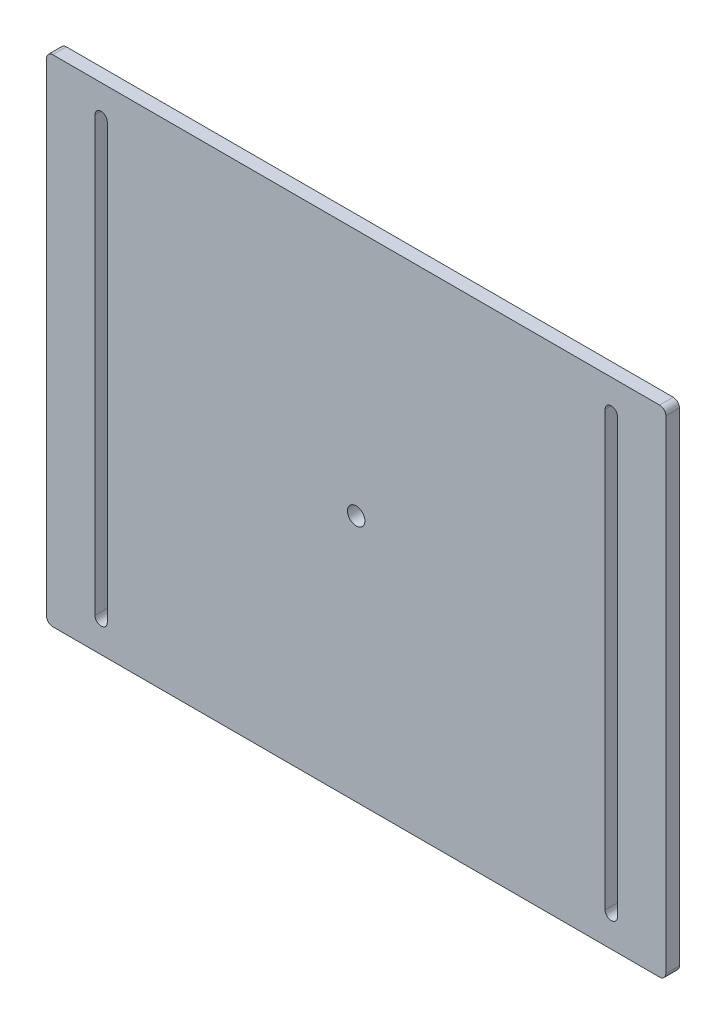
from build123d import *

# Parameters (mm, degrees)
SKETCH1_W               = 254
SKETCH1_H               = 203.2
BOSS_EXTRUDE1_DEPTH     = 5.588
F_1_4_CLEARANCE_HOLE1_D = 7.14248
FILLET1_R               = 2.54


with BuildPart() as part:
    # Sketch1 → Boss-Extrude1 (new body)
    with BuildSketch(Plane.XY):
        Rectangle(SKETCH1_W, SKETCH1_H)
        with BuildLine():
            Line((-102.092252, 88.9), (-102.092252, -88.9))
            ThreePointArc((-102.092252, -88.9), (-104.619552, -91.4273), (-107.146852, -88.9))
            Line((-107.146852, -88.9), (-107.146852, 88.9))
            ThreePointArc((-107.146852, 88.9), (-104.619552, 91.4273), (-102.092252, 88.9))
        make_face(mode=Mode.SUBTRACT)
        with BuildLine():
            Line((107.146852, 88.9), (107.146852, -88.9))
            ThreePointArc((107.146852, -88.9), (104.619552, -91.4273), (102.092252, -88.9))
            Line((102.092252, -88.9), (102.092252, 88.9))
            ThreePointArc((102.092252, 88.9), (104.619552, 91.4273), (107.146852, 88.9))
        make_face(mode=Mode.SUBTRACT)
    extrude(amount=BOSS_EXTRUDE1_DEPTH)

    # 1/4 Clearance Hole1 (through all)
    with Locations(Plane.XY.offset(5.588)):
        with Locations((0, 0)):
            Hole(F_1_4_CLEARANCE_HOLE1_D / 2)

    # Fillet1
    fillet1_edges = [part.edges().sort_by_distance(p)[0] for p in [
        (127, -101.6, 2.794),
        (-127, -101.6, 2.794),
        (-127, 101.6, 2.794),
        (127, 101.6, 2.794),
    ]]
    fillet(fillet1_edges, radius=FILLET1_R)


solid = part.part
